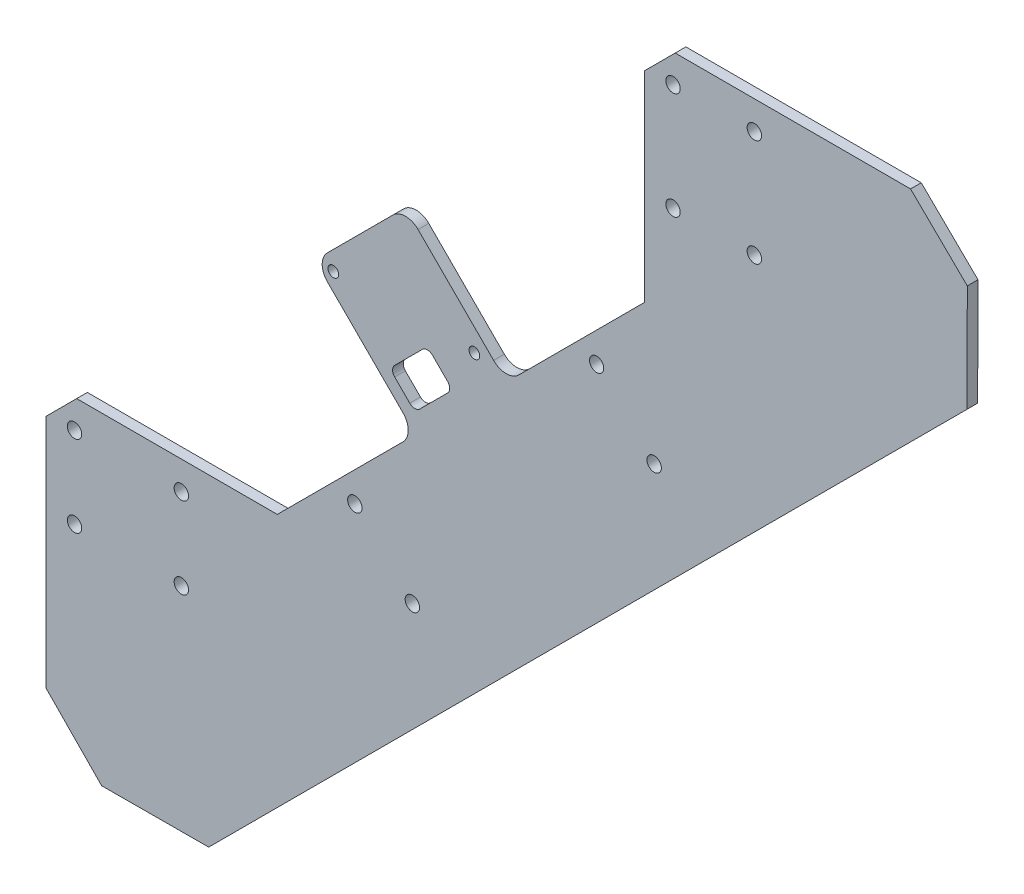
from build123d import *

# Parameters (mm, degrees)
SKETCH1_R           = 2.025
SKETCH1_R_2         = 2
BOSS_EXTRUDE1_DEPTH = 3
BOSS_EXTRUDE2_DEPTH = 3
SKETCH3_R           = 1.5
CUT_EXTRUDE1_DEPTH  = 323.081088677


with BuildPart() as part:
    # Sketch1 → Boss-Extrude1 (new body)
    with BuildSketch(Plane.XY):
        Polygon((-22.319441397, -137.107072194), (-30.931230202, -145.718860999), (-30.931230202, -211.799971874), (-15.316322, -227.735842242), (14.74833584, -227.638274393), (227.638274393, -14.74833584), (227.735842242, 15.316322), (211.799971874, 30.931230202), (145.718860999, 30.931230202), (137.107072194, 22.319441397), (137.107072194, -34.003174495), (34.003174495, -137.107072194), align=None)
        with Locations((-22.931230202, -167.944306144)):
            Circle(SKETCH1_R, mode=Mode.SUBTRACT)
        with Locations((7.068769798, -167.944306144)):
            Circle(SKETCH1_R, mode=Mode.SUBTRACT)
        with Locations((-22.931230202, -145.107072194)):
            Circle(SKETCH1_R, mode=Mode.SUBTRACT)
        with Locations((7.068769798, -145.107072194)):
            Circle(SKETCH1_R, mode=Mode.SUBTRACT)
        with Locations((71.929470696, -139.81172169)):
            Circle(SKETCH1_R, mode=Mode.SUBTRACT)
        with Locations((55.781107706, -123.6633587)):
            Circle(SKETCH1_R, mode=Mode.SUBTRACT)
        with Locations((167.944306144, 22.931230202)):
            Circle(SKETCH1_R, mode=Mode.SUBTRACT)
        with Locations((139.81172169, -71.929470696)):
            Circle(SKETCH1_R, mode=Mode.SUBTRACT)
        with Locations((145.107072194, -7.068769798)):
            Circle(SKETCH1_R, mode=Mode.SUBTRACT)
        with Locations((145.107072194, 22.931230202)):
            Circle(SKETCH1_R, mode=Mode.SUBTRACT)
        with Locations((167.944306144, -7.068769798)):
            Circle(SKETCH1_R, mode=Mode.SUBTRACT)
        with Locations((123.6633587, -55.781107706)):
            Circle(SKETCH1_R_2, mode=Mode.SUBTRACT)
    extrude(amount=BOSS_EXTRUDE1_DEPTH)

    # Sketch2 → Boss-Extrude2 (add)
    with BuildSketch(Plane.XY.offset(3)):
        with BuildLine():
            Line((66.463240253, -48.078463942), (48.078463942, -66.463240253))
            ThreePointArc((48.078463942, -66.463240253), (46.613997848, -69.998774159), (48.078463942, -73.534308065))
            Line((48.078463942, -73.534308065), (69.291667378, -94.7475115))
            ThreePointArc((69.291667378, -94.7475115), (70.756133472, -98.283045406), (69.291667378, -101.818579312))
            Line((69.291667378, -101.818579312), (72.827201283, -98.283045406))
            Line((72.827201283, -98.283045406), (85.555123345, -85.555123345))
            Line((85.555123345, -85.555123345), (98.283045406, -72.827201283))
            Line((98.283045406, -72.827201283), (101.818579312, -69.291667378))
            ThreePointArc((101.818579312, -69.291667378), (98.283045406, -70.756133472), (94.7475115, -69.291667378))
            Line((94.7475115, -69.291667378), (73.534308065, -48.078463942))
            ThreePointArc((73.534308065, -48.078463942), (69.998774159, -46.613997848), (66.463240253, -48.078463942))
        make_face()
    extrude(amount=-BOSS_EXTRUDE2_DEPTH)

    # Sketch3 → Cut-Extrude1 (cut, through all)
    with BuildSketch(Plane.XY.offset(3)):
        with Locations((49.744824715, -70.173841205)):
            Circle(SKETCH3_R)
        with Locations((89.342804461, -70.173841205)):
            Circle(SKETCH3_R)
        with BuildLine():
            Line((66.95938056, -87.220709483), (71.202021247, -91.46335017))
            ThreePointArc((71.202021247, -91.46335017), (72.61623481, -92.049136607), (74.030448372, -91.46335017))
            Line((74.030448372, -91.46335017), (81.808622965, -83.685175577))
            ThreePointArc((81.808622965, -83.685175577), (82.394409403, -82.270962014), (81.808622965, -80.856748452))
            Line((81.808622965, -80.856748452), (77.565982278, -76.614107765))
            ThreePointArc((77.565982278, -76.614107765), (76.151768716, -76.028321327), (74.737555153, -76.614107765))
            Line((74.737555153, -76.614107765), (66.95938056, -84.392282358))
            ThreePointArc((66.95938056, -84.392282358), (66.373594123, -85.80649592), (66.95938056, -87.220709483))
        make_face()
    extrude(amount=-CUT_EXTRUDE1_DEPTH, mode=Mode.SUBTRACT)


solid = part.part
